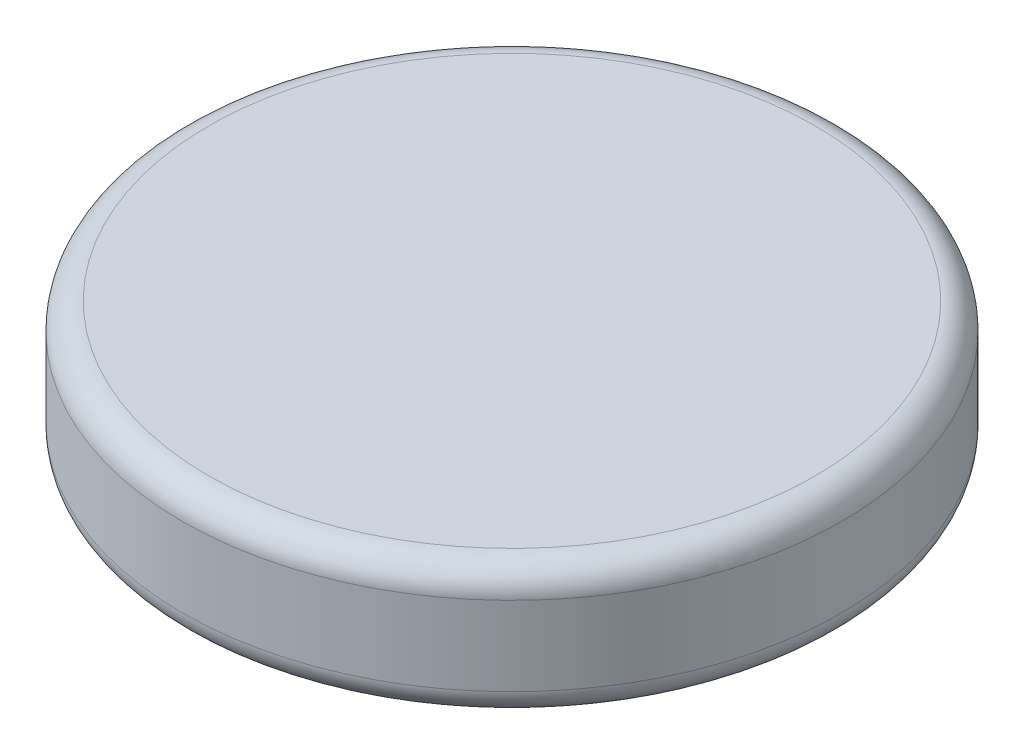
from build123d import *

# Parameters (mm, degrees)
CROQUIS1_R              = 125
SALIENTE_EXTRUIR1_DEPTH = 50
REDONDEO2_R             = 10


with BuildPart() as part:
    # Croquis1 → Saliente-Extruir1 (new body)
    with BuildSketch(Plane(origin=(0, 0, 0), x_dir=(1, 0, 0), z_dir=(0, 1, 0))):
        with Locations(Location((0, 0, 0), (0, 0, 270))):
            Circle(CROQUIS1_R)
    extrude(amount=SALIENTE_EXTRUIR1_DEPTH)

    # Redondeo2
    redondeo2_edges = [part.edges().sort_by_distance(p)[0] for p in [
        (0, 0, -125),
        (0, 50, -125),
    ]]
    fillet(redondeo2_edges, radius=REDONDEO2_R)


solid = part.part
